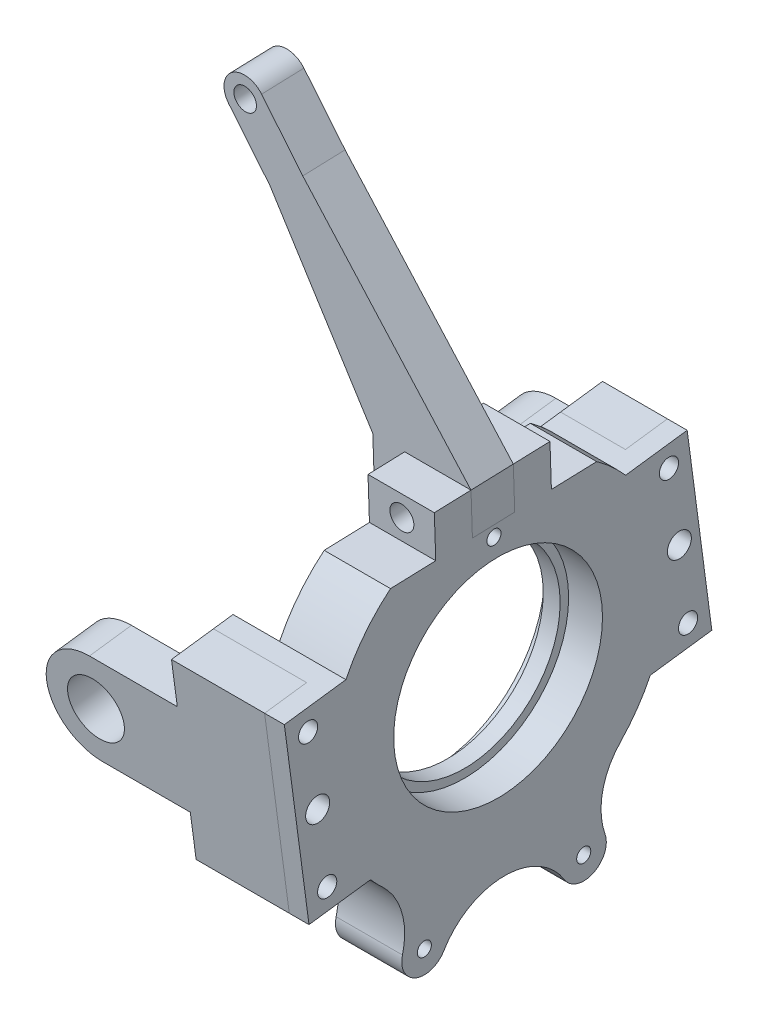
from build123d import *

# Parameters (mm, degrees)
BOSS_EXTRUDE1_DEPTH  = 23.5
SKETCH2_R            = 40
SKETCH2_R_2          = 2.5
CUT_EXTRUDE3_DEPTH   = 54.5
SKETCH3_R            = 4.25
CUT_EXTRUDE4_DEPTH   = 54.5
SKETCH5_W            = 30
SKETCH5_H            = 66.33
BOSS_EXTRUDE2_DEPTH  = 7
SKETCH8_W            = 7
SKETCH8_H            = 66.33
BOSS_EXTRUDE4_DEPTH  = 15
SKETCH9_R            = 3.4
SKETCH9_R_2          = 4.25
CUT_EXTRUDE7_DEPTH   = 15
SKETCH13_W           = 40
SKETCH13_H           = 66.33
BOSS_EXTRUDE9_DEPTH  = 7
SKETCH16_W           = 7
SKETCH16_H           = 66.33
BOSS_EXTRUDE10_DEPTH = 15
SKETCH18_R           = 3.4
SKETCH18_R_2         = 4.25
CUT_EXTRUDE10_DEPTH  = 15
SKETCH19_R           = 40
SKETCH19_R_2         = 34
BOSS_EXTRUDE11_DEPTH = 6
BOSS_EXTRUDE12_START = 12
SKETCH20_R           = 40
SKETCH20_R_2         = 37
BOSS_EXTRUDE12_DEPTH = 12
SKETCH22_R           = 10
BOSS_EXTRUDE13_DEPTH = 15
CUT_EXTRUDE11_START  = -28
SKETCH23_R           = 3.4
SKETCH23_R_2         = 4.25
CUT_EXTRUDE11_DEPTH  = 28
CUT_EXTRUDE12_START  = -62
SKETCH23_2_R         = 3.4
CUT_EXTRUDE12_DEPTH  = 62
CUT_EXTRUDE13_START  = -62
SKETCH23_3_R         = 3.4
CUT_EXTRUDE13_DEPTH  = 62
SKETCH25_R           = 10
BOSS_EXTRUDE14_DEPTH = 15
BOSS_EXTRUDE15_DEPTH = 15
SKETCH26_4_R         = 4
CUT_EXTRUDE15_DEPTH  = 89
SKETCH2_2_R          = 2.5
CUT_EXTRUDE16_DEPTH  = 89
SKETCH27_R           = 4.25
CUT_EXTRUDE17_DEPTH  = 36


with BuildPart() as part:
    # Sketch1 → Boss-Extrude1 (new body)
    with BuildSketch(Plane(origin=(520, -2.549021019, 292.088877727), x_dir=(0, 0, 1), z_dir=(-1, 0, 0))):
        with BuildLine():
            Line((22.089774265, 46.867302095), (22.594580859, 61.858805365))
            Line((22.594580859, 61.858805365), (9.601944692, 62.296304413))
            Line((9.601944692, 62.296304413), (9.097138098, 47.304801143))
            Line((9.097138098, 47.304801143), (-5.894365173, 47.809607737))
            Line((-5.894365173, 47.809607737), (-5.389558579, 62.801111007))
            Line((-5.389558579, 62.801111007), (-18.382194746, 63.238610055))
            Line((-18.382194746, 63.238610055), (-18.88700134, 48.247106785))
            Line((-18.88700134, 48.247106785), (-34.925795618, 48.787178648))
            ThreePointArc((-34.925795618, 48.787178648), (-40.332079644, 44.422104313), (-45.197445717, 39.461258224))
            Line((-45.197445717, 39.461258224), (-53.93314887, -26.290976646))
            ThreePointArc((-53.93314887, -26.290976646), (-49.249735275, -34.270447552), (-43.395185974, -41.434983218))
            ThreePointArc((-43.395185974, -41.434983218), (-37.0364227, -53.438194383), (-37.892802357, -66.994652715))
            ThreePointArc((-37.892802357, -66.994652715), (-33.796367, -76.866773964), (-23.541076661, -73.855365549))
            ThreePointArc((-23.541076661, -73.855365549), (-2.022997547, -62.001276647), (19.251106158, -74.287841015))
            ThreePointArc((19.251106158, -74.287841015), (29.196183083, -77.613035185), (33.889712216, -68.235815149))
            ThreePointArc((33.889712216, -68.235815149), (34.108079038, -55.03719694), (41.017838842, -43.789689389))
            ThreePointArc((41.017838842, -43.789689389), (43.161935221, -41.677899995), (45.197445717, -39.461258224))
            Line((45.197445717, -39.461258224), (53.93314887, 26.290976646))
            ThreePointArc((53.93314887, 26.290976646), (47.108415572, 37.159079407), (38.128568543, 46.327230231))
            Line((38.128568543, 46.327230231), (22.089774265, 46.867302095))
        make_face()
    extrude(amount=BOSS_EXTRUDE1_DEPTH)

    # Sketch2 → Cut-Extrude3 (cut)
    with BuildSketch(Plane.YZ.offset(520)):
        with Locations(Location((-2.549021019, 292.088877727, 0), (0, 0, 270))):
            Circle(SKETCH2_R)
        with Locations(Location((-72.768971159, 318.228544244, 0), (0, 0, 270))):
            Circle(SKETCH2_R_2)
        with Locations(Location((-72.198103544, 261.742862924, 0), (0, 0, 270))):
            Circle(SKETCH2_R_2)
        with Locations(Location((41.218252228, 293.562646417, 0), (0, 0, 270))):
            Circle(SKETCH2_R_2)
    extrude(amount=-CUT_EXTRUDE3_DEPTH, mode=Mode.SUBTRACT)

    # Sketch3 → Cut-Extrude4 (cut)
    with BuildSketch(Plane(origin=(0, -10.517113943, 312.332188133), x_dir=(1, 0, 0), z_dir=(1.6236027295165796e-15, -0.03365377293051974, 0.999433551351735))):
        with Locations(Location((508.25, 62.366474059, 0), (0, 0, 270))):
            Circle(SKETCH3_R)
    extrude(amount=-CUT_EXTRUDE4_DEPTH, mode=Mode.SUBTRACT)

    # Sketch5 → Boss-Extrude2 (add)
    with BuildSketch(Plane(origin=(0, -31.592286251, 237.790065605), x_dir=(1, 0, 0), z_dir=(-1.722759387163354e-15, 0.13170063549249003, -0.991289535206982))):
        with Locations((505, -35.941472956)):
            Rectangle(SKETCH5_W, SKETCH5_H)
    extrude(amount=BOSS_EXTRUDE2_DEPTH)

    # Sketch8 → Boss-Extrude4 (add)
    with BuildSketch(Plane(origin=(0, -30.670381803, 230.851038858), x_dir=(1, 0, 0), z_dir=(-2.1092287106944035e-15, 0.13170063549249048, -0.9912895352069819))):
        with Locations((516.5, -35.941472956)):
            Rectangle(SKETCH8_W, SKETCH8_H)
    extrude(amount=BOSS_EXTRUDE4_DEPTH)

    # Sketch9 → Cut-Extrude7 (cut)
    with BuildSketch(Plane(origin=(513, 0, 0), x_dir=(0, -1, 0), z_dir=(-1, 0, 0))):
        with Locations(Location((-31.387224906, 231.529978983, 0), (0, 0, 90))):
            Circle(SKETCH9_R)
        with Locations(Location((-5.985719838, 227.849253782, 0), (0, 0, 90))):
            Circle(SKETCH9_R_2)
        with Locations(Location((19.495666937, 224.769785363, 0), (0, 0, 270))):
            Circle(SKETCH9_R)
    extrude(amount=-CUT_EXTRUDE7_DEPTH, mode=Mode.SUBTRACT)

    # Sketch13 → Boss-Extrude9 (add)
    with BuildSketch(Plane(origin=(0, -44.762567829, 336.920660192), x_dir=(1, 0, 0), z_dir=(1.7227593871633543e-15, -0.13170063549248964, 0.991289535206982))):
        with Locations((500, 35.941472956)):
            Rectangle(SKETCH13_W, SKETCH13_H)
    extrude(amount=BOSS_EXTRUDE9_DEPTH)

    # Sketch16 → Boss-Extrude10 (add)
    with BuildSketch(Plane(origin=(0, -45.684472277, 343.859686938), x_dir=(1, 0, 0), z_dir=(1.998401444325282e-15, -0.13170063549248945, 0.9912895352069822))):
        with Locations((516.5, 35.941472956)):
            Rectangle(SKETCH16_W, SKETCH16_H)
    extrude(amount=BOSS_EXTRUDE10_DEPTH)

    # Sketch18 → Cut-Extrude10 (cut)
    with BuildSketch(Plane(origin=(513, 0, 0), x_dir=(0, -1, 0), z_dir=(-1, 0, 0))):
        with Locations(Location((-14.397624898, 359.407970091, 0), (0, 0, 90))):
            Circle(SKETCH18_R)
        with Locations(Location((11.043821023, 356.027873281, 0), (0, 0, 90))):
            Circle(SKETCH18_R_2)
        with Locations(Location((36.485266944, 352.647776471, 0), (0, 0, 270))):
            Circle(SKETCH18_R)
    extrude(amount=-CUT_EXTRUDE10_DEPTH, mode=Mode.SUBTRACT)

    # Sketch19 → Boss-Extrude11 (add)
    with BuildSketch(Plane(origin=(508, -2.549021019, 292.088877727), x_dir=(0, 0, 1), z_dir=(-1, 0, 0))):
        with Locations(Location((0, 0, 0), (0, 0, 180))):
            Circle(SKETCH19_R)
        Circle(SKETCH19_R_2, mode=Mode.SUBTRACT)
    extrude(amount=BOSS_EXTRUDE11_DEPTH)

    # Sketch20 → Boss-Extrude12 (add)
    with BuildSketch(Plane.YZ.offset(508).offset(BOSS_EXTRUDE12_START)):
        with Locations(Location((-2.549021019, 292.088877727, 0), (0, 0, 270))):
            Circle(SKETCH20_R)
        with Locations(Location((-2.549021019, 292.088877727, 0), (0, 0, 270))):
            Circle(SKETCH20_R_2, mode=Mode.SUBTRACT)
    extrude(amount=-BOSS_EXTRUDE12_DEPTH)


with BuildPart() as body_2:
    # Sketch22 → Boss-Extrude13 (new body)
    with BuildSketch(Plane(origin=(0, -45.684472277, 343.859686938), x_dir=(1, 0, 0), z_dir=(1.7069679003611784e-15, -0.13170063549248986, 0.9912895352069819))):
        with BuildLine():
            Line((448.877, 18.441472956), (480, 18.441472956))
            Line((480, 18.441472956), (480, 2.776472956))
            Line((480, 2.776472956), (513, 2.776472956))
            Line((513, 2.776472956), (513, 69.106472956))
            Line((513, 69.106472956), (480, 69.106472956))
            Line((480, 69.106472956), (480, 53.441472956))
            Line((480, 53.441472956), (448.877, 53.441472956))
            ThreePointArc((448.877, 53.441472956), (431.377, 35.941472956), (448.877, 18.441472956))
        make_face()
        with Locations(Location((448.877, 35.941472956, 0), (0, 0, 270))):
            Circle(SKETCH22_R, mode=Mode.SUBTRACT)
    extrude(amount=BOSS_EXTRUDE13_DEPTH)

    # Sketch23 → Cut-Extrude11 (cut)
    with BuildSketch(Plane.YZ.offset(513).offset(CUT_EXTRUDE11_START)):
        with Locations(Location((-36.485266944, 352.647776471, 0), (0, 0, 270))):
            Circle(SKETCH23_R)
        with Locations(Location((-11.043821023, 356.027873281, 0), (0, 0, 270))):
            Circle(SKETCH23_R_2)
        with Locations(Location((14.397624898, 359.407970091, 0), (0, 0, 90))):
            Circle(SKETCH23_R)
    extrude(amount=CUT_EXTRUDE11_DEPTH, mode=Mode.SUBTRACT)

    # Sketch23<2> → Cut-Extrude12 (cut)
    with BuildSketch(Plane.YZ.offset(513).offset(CUT_EXTRUDE12_START)):
        with Locations(Location((14.397624898, 359.407970091, 0), (0, 0, 270))):
            Circle(SKETCH23_2_R)
    extrude(amount=CUT_EXTRUDE12_DEPTH, mode=Mode.SUBTRACT)

    # Sketch23<3> → Cut-Extrude13 (cut)
    with BuildSketch(Plane.YZ.offset(513).offset(CUT_EXTRUDE13_START)):
        with Locations(Location((-36.485266944, 352.647776471, 0), (0, 0, 270))):
            Circle(SKETCH23_3_R)
    extrude(amount=CUT_EXTRUDE13_DEPTH, mode=Mode.SUBTRACT)


with BuildPart() as body_3:
    # Sketch25 → Boss-Extrude14 (new body)
    with BuildSketch(Plane(origin=(0, -30.670381803, 230.851038858), x_dir=(1, 0, 0), z_dir=(-2.109228710694403e-15, 0.13170063549249045, -0.9912895352069818))):
        with BuildLine():
            Line((490, -69.106472956), (513, -69.106472956))
            Line((513, -69.106472956), (513, -2.776472956))
            Line((513, -2.776472956), (490, -2.776472956))
            Line((490, -2.776472956), (490, -18.441472956))
            Line((490, -18.441472956), (480, -18.441472956))
            Line((480, -18.441472956), (471.393, -18.441472956))
            ThreePointArc((471.393, -18.441472956), (453.893, -35.941472956), (471.393, -53.441472956))
            Line((471.393, -53.441472956), (480, -53.441472956))
            Line((480, -53.441472956), (490, -53.441472956))
            Line((490, -53.441472956), (490, -69.106472956))
        make_face()
        with Locations(Location((471.393, -35.941472956, 0), (0, 0, 90))):
            Circle(SKETCH25_R, mode=Mode.SUBTRACT)
    extrude(amount=BOSS_EXTRUDE14_DEPTH)


with BuildPart() as body_4:
    # Sketch26 → Boss-Extrude15 (new body)
    with BuildSketch(Plane(origin=(0, -9.574808301, 284.348048695), x_dir=(1, 0, 0), z_dir=(1.6236027295165587e-15, -0.033653772930500696, 0.9994335513517356))):
        with BuildLine():
            Line((496.5, 54.866474059), (496.5, 47.784453864))
            Line((496.5, 47.784453864), (485.201806312, 47.784453864))
            Line((485.201806312, 47.784453864), (485.201806312, 69.866474059))
            Line((485.201806312, 69.866474059), (450.757106274, 129.770465291))
            Line((450.757106274, 129.770465291), (436.786998712, 148.192500608))
            ThreePointArc((436.786998712, 148.192500608), (438.231178225, 158.700323671), (448.739001288, 157.256144158))
            Line((448.739001288, 157.256144158), (462.709108851, 138.834108842))
            Line((462.709108851, 138.834108842), (520, 69.866474059))
            Line((520, 69.866474059), (520, 54.866474059))
            Line((520, 54.866474059), (496.5, 54.866474059))
        make_face()
    extrude(amount=BOSS_EXTRUDE15_DEPTH)

    # Sketch26<4> → Cut-Extrude15 (cut)
    with BuildSketch(Plane(origin=(0, -9.574808301, 284.348048695), x_dir=(1, 0, 0), z_dir=(1.6236027295165587e-15, -0.033653772930500696, 0.9994335513517356))):
        with Locations(Location((442.763, 152.724322383, 0), (0, 0, 90))):
            Circle(SKETCH26_4_R)
    extrude(amount=CUT_EXTRUDE15_DEPTH, mode=Mode.SUBTRACT)

    # Sketch2<2> → Cut-Extrude16 (cut)
    with BuildSketch(Plane.YZ.offset(520)):
        with Locations(Location((41.218252228, 293.562646417, 0), (0, 0, 270))):
            Circle(SKETCH2_2_R)
    extrude(amount=-CUT_EXTRUDE16_DEPTH, mode=Mode.SUBTRACT)

    # Sketch27 → Cut-Extrude17 (cut)
    with BuildSketch(Plane(origin=(0, -10.079614895, 299.339551965), x_dir=(1, 0, 0), z_dir=(1.623602729516559e-15, -0.033653772930500696, 0.9994335513517356))):
        with Locations(Location((508.25, 62.366474059, 0), (0, 0, 270))):
            Circle(SKETCH27_R)
    extrude(amount=-CUT_EXTRUDE17_DEPTH, mode=Mode.SUBTRACT)


solid = Compound([part.part, body_2.part, body_3.part, body_4.part])
